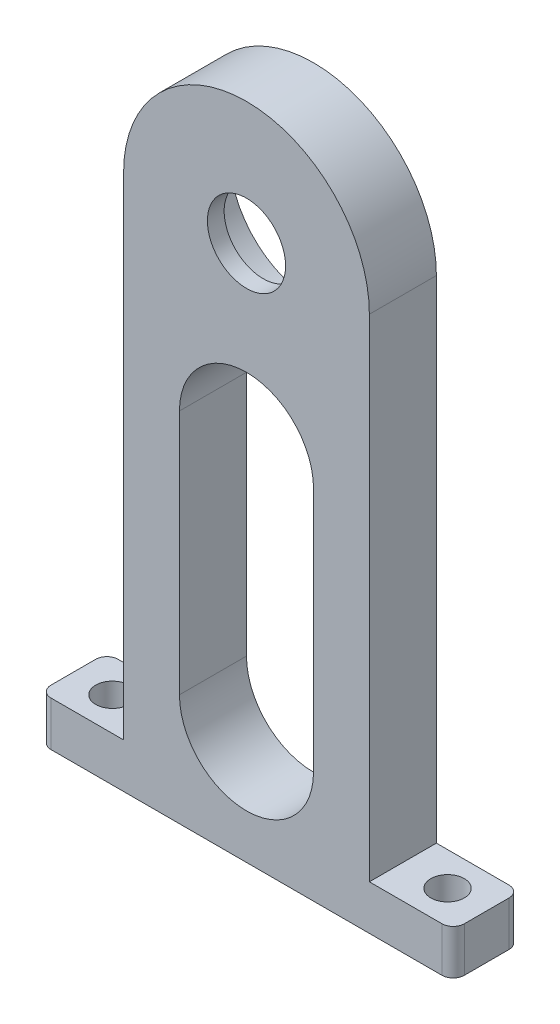
from build123d import *

# Parameters (mm, degrees)
SKETCH1_R           = 7
BOSS_EXTRUDE2_DEPTH = 12
SKETCH3_R           = 3
CUT_EXTRUDE1_DEPTH  = 125.245724273
SKETCH1_4_R         = 15
SKETCH1_4_R_2       = 7
CUT_EXTRUDE2_DEPTH  = 9
FILLET1_R           = 2


with BuildPart() as part:
    # Sketch1 → Boss-Extrude2 (new body)
    with BuildSketch(Plane.XY):
        with BuildLine():
            Line((22, -88), (22, 0))
            ThreePointArc((22, 0), (0, 22), (-22, 0))
            Line((-22, 0), (-22, -88))
            Line((-22, -88), (-37, -88))
            Line((-37, -88), (-37, -96))
            Line((-37, -96), (37, -96))
            Line((37, -96), (37, -88))
            Line((37, -88), (22, -88))
        make_face()
        with BuildLine():
            ThreePointArc((-12, -32), (0, -20), (12, -32))
            Line((12, -32), (12, -76))
            ThreePointArc((12, -76), (0, -88), (-12, -76))
            Line((-12, -76), (-12, -32))
        make_face(mode=Mode.SUBTRACT)
        Circle(SKETCH1_R, mode=Mode.SUBTRACT)
    extrude(amount=BOSS_EXTRUDE2_DEPTH)

    # Sketch3 → Cut-Extrude1 (cut, through all)
    with BuildSketch(Plane.XZ.offset(96)):
        with Locations((-30, 6)):
            Circle(SKETCH3_R)
        with Locations((30, 6)):
            Circle(SKETCH3_R)
    extrude(amount=-CUT_EXTRUDE1_DEPTH, mode=Mode.SUBTRACT)

    # Sketch1<4> → Cut-Extrude2 (cut)
    with BuildSketch(Plane.XY):
        Circle(SKETCH1_4_R)
        Circle(SKETCH1_4_R_2, mode=Mode.SUBTRACT)
    extrude(amount=CUT_EXTRUDE2_DEPTH, mode=Mode.SUBTRACT)

    # Fillet1
    fillet1_edges = [part.edges().sort_by_distance(p)[0] for p in [
        (-37, -92, 0),
        (-37, -92, 12),
        (37, -92, 0),
        (37, -92, 12),
    ]]
    fillet(fillet1_edges, radius=FILLET1_R)


solid = part.part
